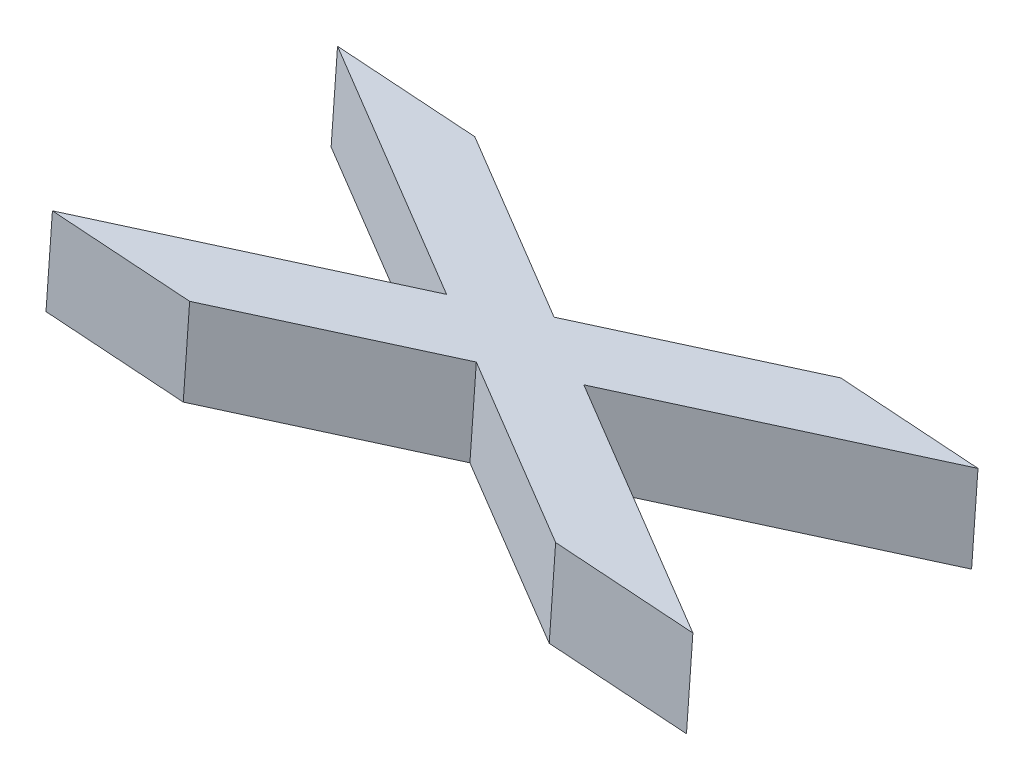
from build123d import *

# Parameters (mm, degrees)
BOSS_EXTRUDE1_DEPTH = 8.89


with BuildPart() as part:
    # Sketch1 → Boss-Extrude1 (new body)
    with BuildSketch(Plane(origin=(3.332062131, 47.048717286, 0), x_dir=(0.9975015501295322, -0.07064458570322477, 0), z_dir=(0.07064458570322477, 0.9975015501295322, 0))):
        Polygon((-69.658826246, -66.689059093), (-51.681510825, -56.529059093), (-33.704195404, -66.689059093), (-20.221208838, -66.689059093), (-44.940017542, -52.719059093), (-20.221208838, -38.749059093), (-33.704195404, -38.749059093), (-51.681510825, -48.909059093), (-69.658826246, -38.749059093), (-83.141812813, -38.749059093), (-58.423004108, -52.719059093), (-83.141812813, -66.689059093), align=None)
    extrude(amount=-BOSS_EXTRUDE1_DEPTH)


solid = part.part
